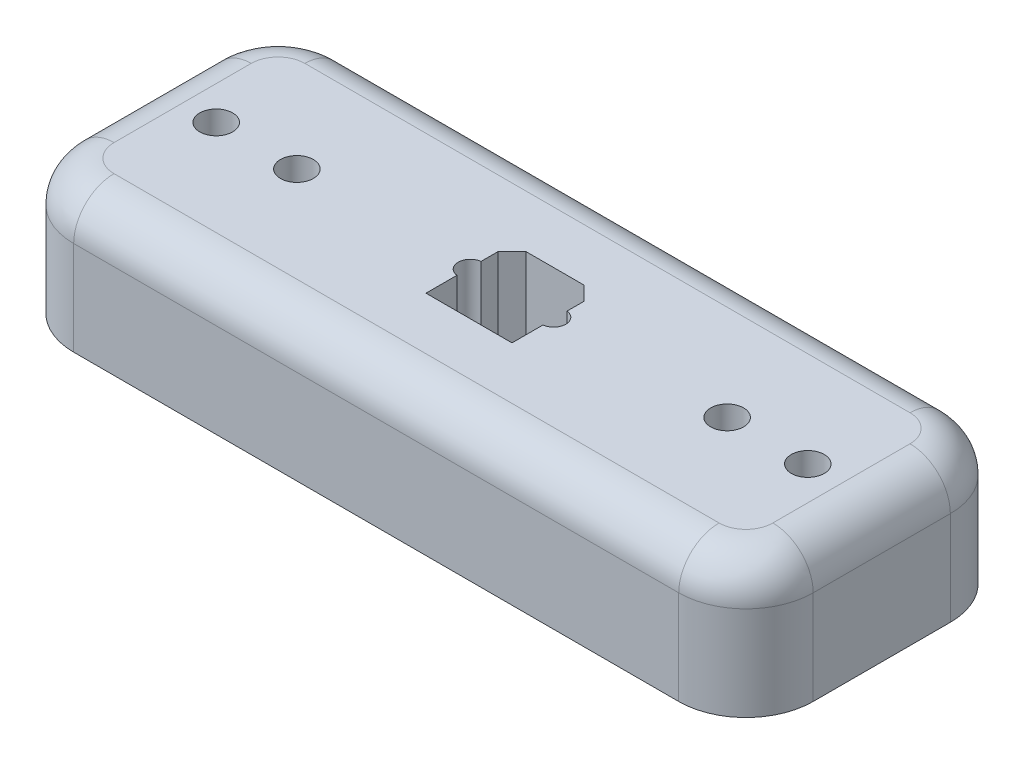
from build123d import *

# Parameters (mm, degrees)
SKETCH_1_R      = 1.225
EXTRUDE_1_DEPTH = 10
SKETCH_1_7_R    = 1.25
EXTRUDE_2_DEPTH = 2.5
FILLET_1_R      = 3


with BuildPart() as part:
    # 草图1 → 凸台-拉伸1 (new body)
    with BuildSketch(Plane(origin=(0, 0, 0), x_dir=(1, 0, 0), z_dir=(0, 1, 0))):
        with BuildLine():
            ThreePointArc((-22.5, 10.1), (-26.035533906, 8.635533906), (-27.5, 5.1))
            Line((-27.5, 5.1), (-27.5, -5.1))
            ThreePointArc((-27.5, -5.1), (-26.035533906, -8.635533906), (-22.5, -10.1))
            Line((-22.5, -10.1), (22.5, -10.1))
            ThreePointArc((22.5, -10.1), (26.035533906, -8.635533906), (27.5, -5.1))
            Line((27.5, -5.1), (27.5, 5.1))
            ThreePointArc((27.5, 5.1), (26.035533906, 8.635533906), (22.5, 10.1))
            Line((22.5, 10.1), (-22.5, 10.1))
        make_face()
        with Locations((-22, 0)):
            Circle(SKETCH_1_R, mode=Mode.SUBTRACT)
        with Locations((-16, 0)):
            Circle(SKETCH_1_R, mode=Mode.SUBTRACT)
        with BuildLine():
            Line((3.2, -3.2), (-3.2, -3.2))
            Line((-3.2, -3.2), (-3.2, -0.894427191))
            ThreePointArc((-3.2, -0.894427191), (-4, 0), (-3.2, 0.894427191))
            Line((-3.2, 0.894427191), (-3.2, 2.141421356))
            Line((-3.2, 2.141421356), (-2.141421356, 3.2))
            Line((-2.141421356, 3.2), (2.141421356, 3.2))
            Line((2.141421356, 3.2), (3.2, 2.141421356))
            Line((3.2, 2.141421356), (3.2, 0.894427191))
            ThreePointArc((3.2, 0.894427191), (4, 0), (3.2, -0.894427191))
            Line((3.2, -0.894427191), (3.2, -3.2))
        make_face(mode=Mode.SUBTRACT)
        with Locations((16, 0)):
            Circle(SKETCH_1_R, mode=Mode.SUBTRACT)
        with Locations((22, 0)):
            Circle(SKETCH_1_R, mode=Mode.SUBTRACT)
    extrude(amount=EXTRUDE_1_DEPTH)

    # 草图1<7> → 凸台-拉伸2 (add)
    with BuildSketch(Plane(origin=(0, 0, 0), x_dir=(1, 0, 0), z_dir=(0, 1, 0))):
        with BuildLine():
            Line((-3.2, -0.894427191), (-3.2, -3.2))
            Line((-3.2, -3.2), (3.2, -3.2))
            Line((3.2, -3.2), (3.2, -0.894427191))
            ThreePointArc((3.2, -0.894427191), (4, 0), (3.2, 0.894427191))
            Line((3.2, 0.894427191), (3.2, 2.141421356))
            Line((3.2, 2.141421356), (2.141421356, 3.2))
            Line((2.141421356, 3.2), (-2.141421356, 3.2))
            Line((-2.141421356, 3.2), (-3.2, 2.141421356))
            Line((-3.2, 2.141421356), (-3.2, 0.894427191))
            ThreePointArc((-3.2, 0.894427191), (-4, 0), (-3.2, -0.894427191))
        make_face()
        Circle(SKETCH_1_7_R, mode=Mode.SUBTRACT)
    extrude(amount=EXTRUDE_2_DEPTH)

    # 圆角1
    fillet_1_edges = [part.edges().sort_by_distance(p)[0] for p in [
        (-26.035533906, 10, 8.635533906),
        (-26.035533906, 10, -8.635533906),
        (26.035533906, 10, -8.635533906),
        (26.035533906, 10, 8.635533906),
        (-27.5, 10, 0),
        (27.5, 10, 0),
        (0, 10, -10.1),
        (0, 10, 10.1),
    ]]
    fillet(fillet_1_edges, radius=FILLET_1_R)


solid = part.part
